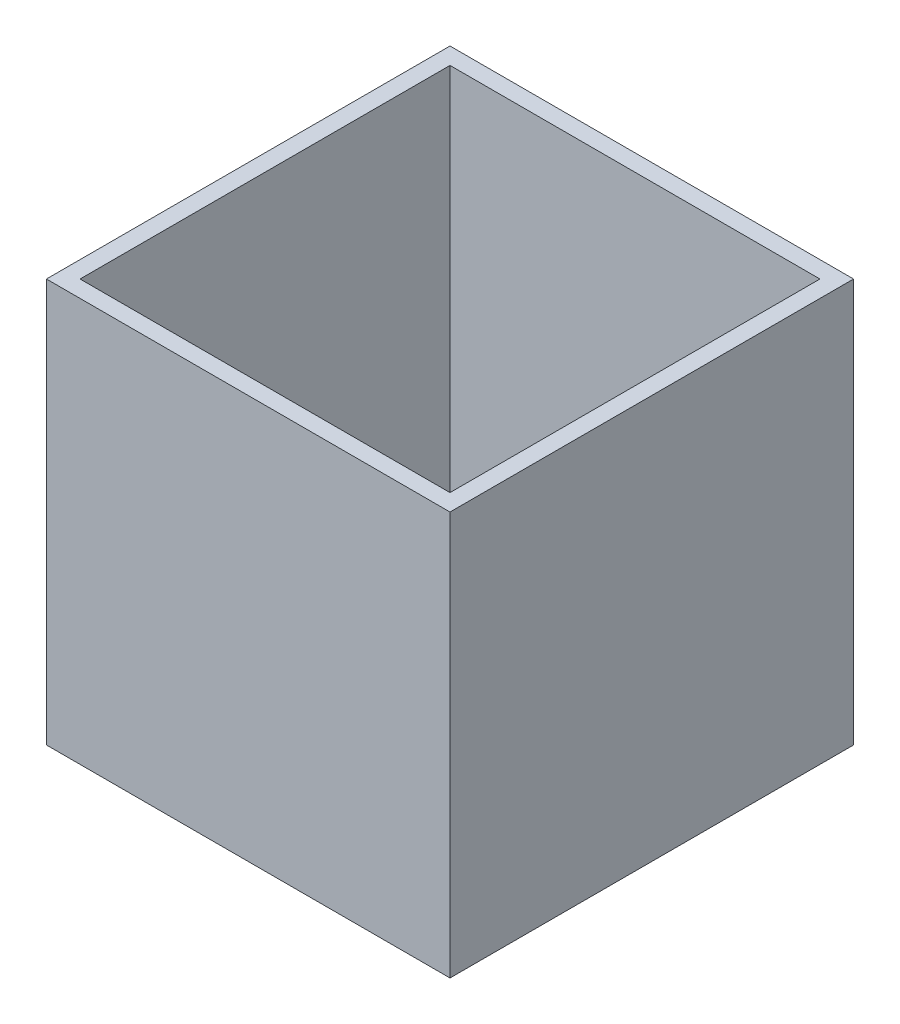
from build123d import *

# Parameters (mm, degrees)
SKETCH1_W                = 304.8
SKETCH1_H                = 304.8
BOSS_EXTRUDE2_DEPTH      = 304.8
SHELL1_T                 = -12.7
SKETCH2_R                = 3.877794573
BOSS_EXTRUDE3_DEPTH      = 6
M2_5X0_45_TAPPED_HOLE3_D = 2.05


with BuildPart() as part:
    # Sketch1 → Boss-Extrude2 (new body)
    with BuildSketch(Plane.XY):
        with Locations((141.322807232, 102.754701441)):
            Rectangle(SKETCH1_W, SKETCH1_H)
    extrude(amount=BOSS_EXTRUDE2_DEPTH)

    # Shell1
    shell1_openings = [part.faces().sort_by_distance(p)[0] for p in [
        (141.322807232, 255.154701441, 152.4),
    ]]
    offset(amount=SHELL1_T, openings=shell1_openings, kind=Kind.INTERSECTION)

    # Sketch2 → Boss-Extrude3 (add)
    with BuildSketch(Plane(origin=(0, -36.945298559, 0), x_dir=(1, 0, 0), z_dir=(0, 1, 0))):
        with Locations(Location((115.822807232, -131.4, 0), (0, 0, 270))):
            Circle(SKETCH2_R)
        with BuildLine():
            Line((168.492325351, -127.9), (165.153289112, -127.9))
            ThreePointArc((165.153289112, -127.9), (164.080792393, -134.142014839), (170.322807232, -133.069518119))
            Line((170.322807232, -133.069518119), (170.322807232, -129.730481881))
            ThreePointArc((170.322807232, -129.730481881), (169.56482207, -128.657985161), (168.492325351, -127.9))
        make_face()
        with BuildLine():
            ThreePointArc((117.492325351, -176.9), (118.56482207, -170.657985161), (112.322807232, -171.730481881))
            Line((112.322807232, -171.730481881), (112.322807232, -175.069518119))
            ThreePointArc((112.322807232, -175.069518119), (113.080792393, -176.142014839), (114.153289112, -176.9))
            Line((114.153289112, -176.9), (117.492325351, -176.9))
        make_face()
        with BuildLine():
            Line((170.322807232, -175.069518119), (170.322807232, -171.730481881))
            ThreePointArc((170.322807232, -171.730481881), (164.080792393, -170.657985161), (165.153289112, -176.9))
            Line((165.153289112, -176.9), (168.492325351, -176.9))
            ThreePointArc((168.492325351, -176.9), (169.56482207, -176.142014839), (170.322807232, -175.069518119))
        make_face()
    extrude(amount=BOSS_EXTRUDE3_DEPTH)

    # M2.5x0.45 Tapped Hole3 (through all)
    with Locations(Plane(origin=(0, -30.945298559, 0), x_dir=(1, 0, 0), z_dir=(0, 1, 0))):
        with Locations((115.822807232, -131.4), (166.822807232, -131.4), (166.822807232, -173.4), (115.822807232, -173.4)):
            Hole(M2_5X0_45_TAPPED_HOLE3_D / 2)


solid = part.part
